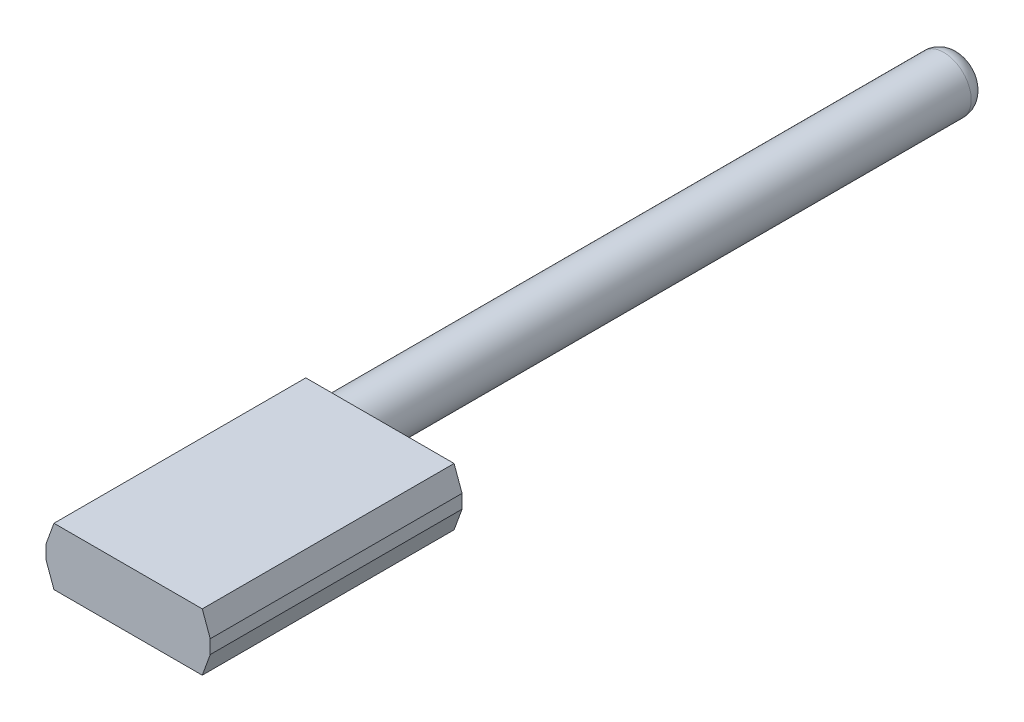
from build123d import *

# Parameters (mm, degrees)
EXTRUDE_1_DEPTH = 46
SKETCH_2_R      = 5
EXTRUDE_2_DEPTH = 113
FILLET_1_R      = 3


with BuildPart() as part:
    # 草圖1 → 填料-伸長1 (new body)
    with BuildSketch(Plane.XY):
        Polygon((-15, 1.25), (-13.544119063, 5.25), (13.544119063, 5.25), (15, 1.25), (15, -1.25), (13.544119063, -5.25), (-13.544119063, -5.25), (-15, -1.25), align=None)
    extrude(amount=EXTRUDE_1_DEPTH)

    # 草圖2 → 填料-伸長2 (add)
    with BuildSketch(Plane(origin=(0, 0, 0), x_dir=(-1, 0, 0), z_dir=(0, 0, -1))):
        with Locations((7, 0)):
            Circle(SKETCH_2_R)
    extrude(amount=EXTRUDE_2_DEPTH)

    # 圓角1
    fillet_1_edges = [part.edges().sort_by_distance(p)[0] for p in [
        (-2, 0, -113),
    ]]
    fillet(fillet_1_edges, radius=FILLET_1_R)


solid = part.part
